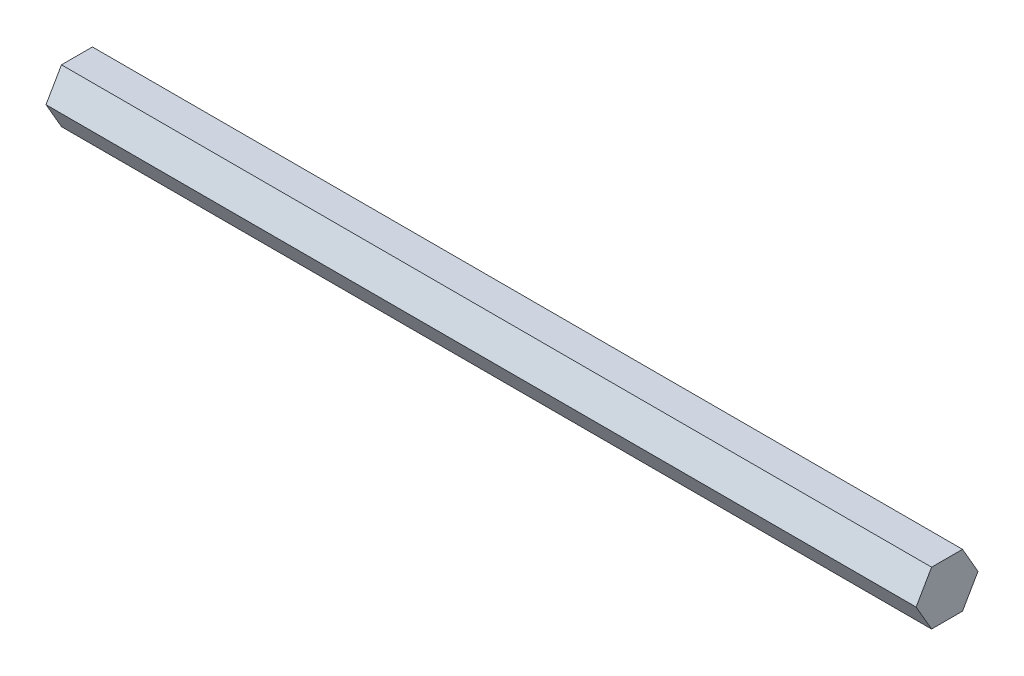
from build123d import *

# Parameters (mm, degrees)
BOSS_EXTRUDE1_DEPTH = 206.1972


with BuildPart() as part:
    # Sketch1 → Boss-Extrude1 (new body)
    with BuildSketch(Plane(origin=(0, 0, 0), x_dir=(0, 0, -1), z_dir=(1, 0, 0))):
        Polygon((3.666174209, 6.35), (-3.666174209, 6.35), (-7.332348419, 0), (-3.666174209, -6.35), (3.666174209, -6.35), (7.332348419, 0), align=None)
    extrude(amount=BOSS_EXTRUDE1_DEPTH)


solid = part.part
